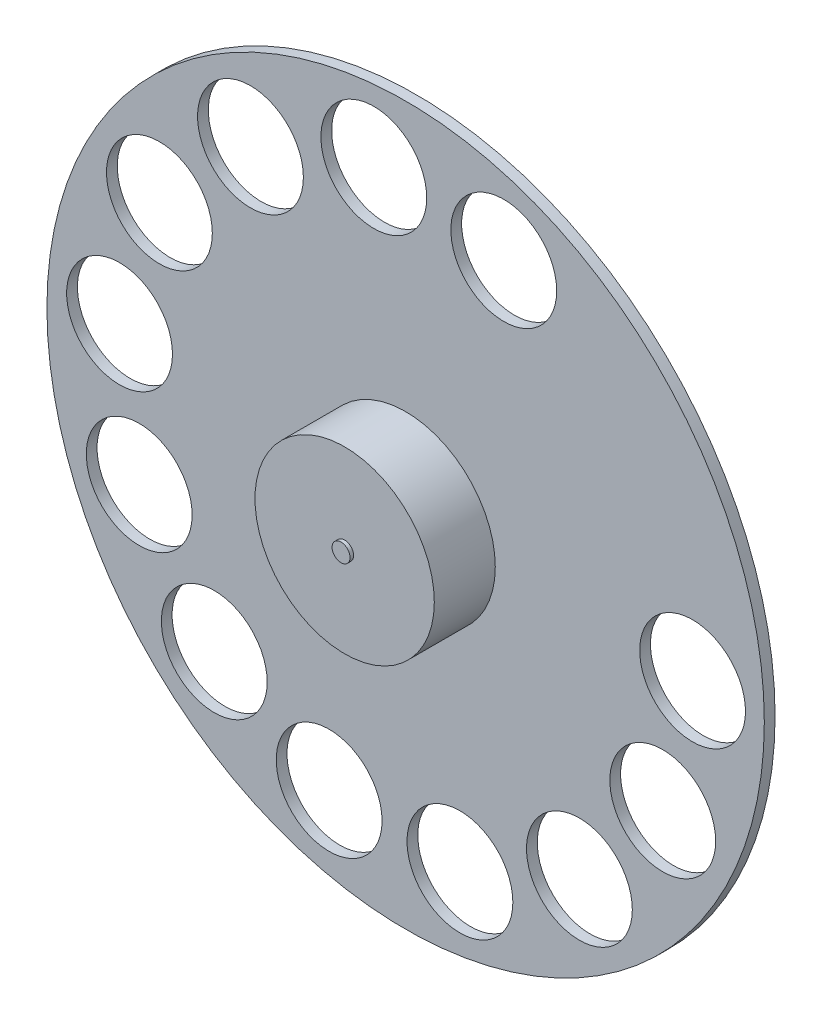
from build123d import *

# Parameters (mm, degrees)
SKETCH1_R           = 100
SKETCH1_R_2         = 14.75
SKETCH1_R_3         = 25
BOSS_EXTRUDE1_DEPTH = 3
SKETCH1_3_R         = 25
BOSS_EXTRUDE2_DEPTH = 20
SKETCH2_R           = 2.5
BOSS_EXTRUDE3_DEPTH = 1


with BuildPart() as part:
    # Sketch1 → Boss-Extrude1 (new body)
    with BuildSketch(Plane.XY):
        Circle(SKETCH1_R)
        with Locations((27.361611466, 75.175409663)):
            Circle(SKETCH1_R_2, mode=Mode.SUBTRACT)
        with Locations((-8.867055992, 79.507077157)):
            Circle(SKETCH1_R_2, mode=Mode.SUBTRACT)
        with Locations((-43.251265396, 67.300282626)):
            Circle(SKETCH1_R_2, mode=Mode.SUBTRACT)
        with Locations((-68.638673059, 41.094191326)):
            Circle(SKETCH1_R_2, mode=Mode.SUBTRACT)
        with Locations((-79.748382076, 6.339996549)):
            Circle(SKETCH1_R_2, mode=Mode.SUBTRACT)
        with Locations((-74.269434641, -29.732996453)):
            Circle(SKETCH1_R_2, mode=Mode.SUBTRACT)
        with Locations((-53.341520041, -59.621155974)):
            Circle(SKETCH1_R_2, mode=Mode.SUBTRACT)
        with Locations((-21.317905095, -77.107372685)):
            Circle(SKETCH1_R_2, mode=Mode.SUBTRACT)
        with Locations((15.140099549, -78.554295781)):
            Circle(SKETCH1_R_2, mode=Mode.SUBTRACT)
        with Locations((48.448774971, -63.660947242)):
            Circle(SKETCH1_R_2, mode=Mode.SUBTRACT)
        with Locations((71.679501943, -35.525329008)):
            Circle(SKETCH1_R_2, mode=Mode.SUBTRACT)
        with Locations((80, 0)):
            Circle(SKETCH1_R_2, mode=Mode.SUBTRACT)
        Circle(SKETCH1_R_3, mode=Mode.SUBTRACT)
    extrude(amount=BOSS_EXTRUDE1_DEPTH)

    # Sketch1<3> → Boss-Extrude2 (add)
    with BuildSketch(Plane.XY):
        Circle(SKETCH1_3_R)
    extrude(amount=BOSS_EXTRUDE2_DEPTH)

    # Sketch2 → Boss-Extrude3 (add)
    with BuildSketch(Plane.XY.offset(20)):
        Circle(SKETCH2_R)
    extrude(amount=BOSS_EXTRUDE3_DEPTH)


solid = part.part
